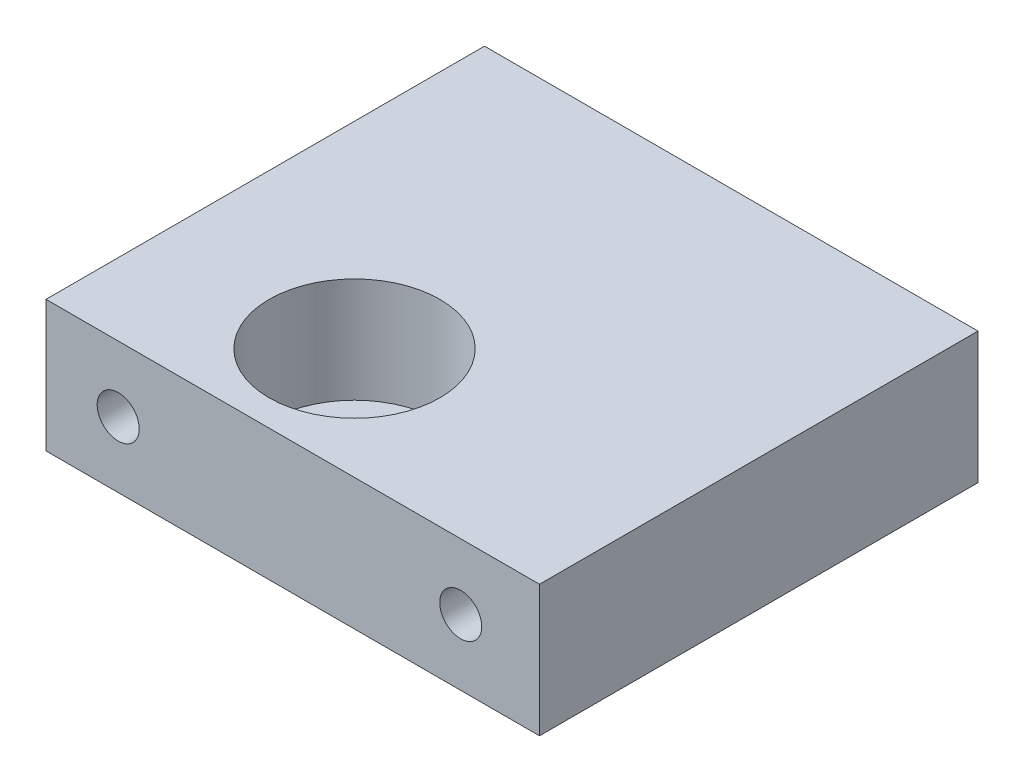
from build123d import *

# Parameters (mm, degrees)
SKETCH1_W           = 37.589281877
SKETCH1_H           = 10
BOSS_EXTRUDE1_DEPTH = 33.4
SKETCH2_R           = 6.5
CUT_EXTRUDE1_DEPTH  = 10
CUT_EXTRUDE3_START  = -33.4
SKETCH3_R           = 1.6
CUT_EXTRUDE3_DEPTH  = 40
SKETCH4_R           = 6.6
SKETCH4_R_2         = 2.75
BOSS_EXTRUDE2_DEPTH = 2


with BuildPart() as part:
    # Sketch1 → Boss-Extrude1 (new body)
    with BuildSketch(Plane.XY):
        with Locations((10.006008035, 10.584218221)):
            Rectangle(SKETCH1_W, SKETCH1_H)
    extrude(amount=BOSS_EXTRUDE1_DEPTH)

    # Sketch2 → Cut-Extrude1 (cut)
    with BuildSketch(Plane(origin=(0, 15.584218221, 0), x_dir=(1, 0, 0), z_dir=(0, 1, 0))):
        with Locations(Location((6.211367096, -24.9, 0), (0, 0, 270))):
            Circle(SKETCH2_R)
    extrude(amount=-CUT_EXTRUDE1_DEPTH, mode=Mode.SUBTRACT)

    # Sketch3 → Cut-Extrude3 (cut)
    with BuildSketch(Plane.XY.offset(33.4).offset(CUT_EXTRUDE3_START)):
        with Locations((-3.288632904, 10.584218221)):
            Circle(SKETCH3_R)
        with Locations((22.800648973, 10.584218221)):
            Circle(SKETCH3_R)
    extrude(amount=CUT_EXTRUDE3_DEPTH, mode=Mode.SUBTRACT)

    # Sketch4 → Boss-Extrude2 (add)
    with BuildSketch(Plane.XZ.offset(-5.584218221)):
        with Locations((6.211367096, 24.9)):
            Circle(SKETCH4_R)
        with Locations(Location((6.211367096, 24.9, 0), (0, 0, 270))):
            Circle(SKETCH4_R_2, mode=Mode.SUBTRACT)
    extrude(amount=-BOSS_EXTRUDE2_DEPTH)


solid = part.part
